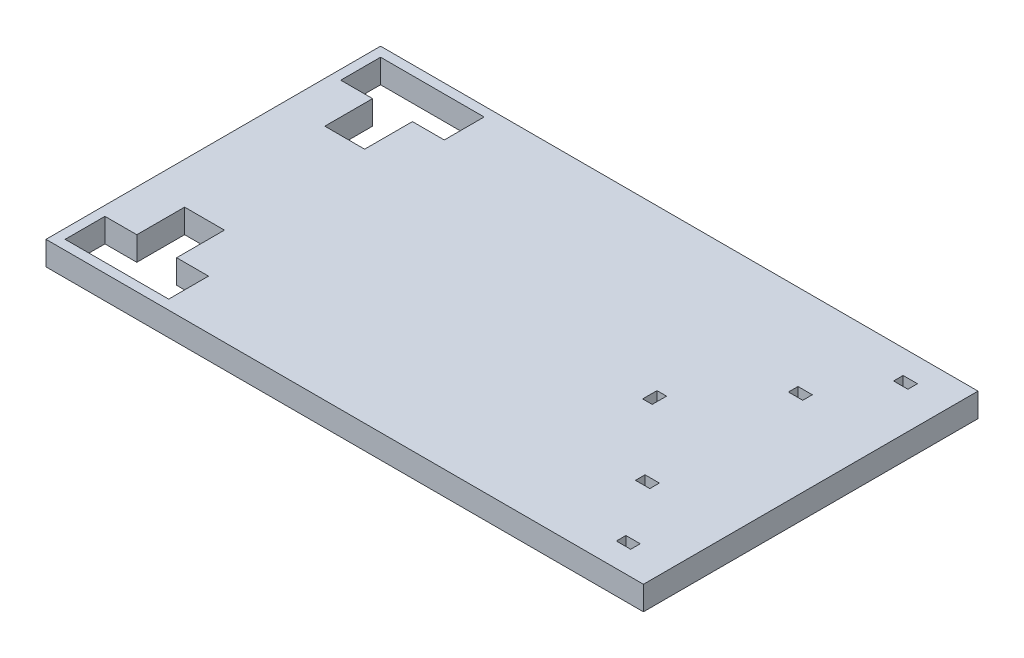
from build123d import *

# Parameters (mm, degrees)
SKETCH1_W           = 375
SKETCH1_H           = 210
BOSS_EXTRUDE1_DEPTH = 15
SKETCH1_5_W         = 25
SKETCH1_5_H         = 30
CUT_EXTRUDE2_DEPTH  = 34
SKETCH1_6_W         = 65
SKETCH1_6_H         = 25
CUT_EXTRUDE3_DEPTH  = 46
SKETCH1_7_W         = 65
SKETCH1_7_H         = 25
CUT_EXTRUDE4_DEPTH  = 48
SKETCH1_8_W         = 25
SKETCH1_8_H         = 30
CUT_EXTRUDE5_DEPTH  = 45
SKETCH1_9_W         = 9
SKETCH1_9_H         = 6
CUT_EXTRUDE6_DEPTH  = 34
SKETCH1_10_W        = 9
SKETCH1_10_H        = 6
CUT_EXTRUDE7_DEPTH  = 31
SKETCH1_11_W        = 6
SKETCH1_11_H        = 9
CUT_EXTRUDE8_DEPTH  = 34
SKETCH1_12_W        = 9
SKETCH1_12_H        = 6
CUT_EXTRUDE9_DEPTH  = 27
SKETCH1_13_W        = 9
SKETCH1_13_H        = 6
CUT_EXTRUDE10_DEPTH = 31


with BuildPart() as part:
    # Sketch1 → Boss-Extrude1 (new body)
    with BuildSketch(Plane(origin=(0, 0, 0), x_dir=(1, 0, 0), z_dir=(0, 1, 0))):
        with Locations((187.5, 105)):
            Rectangle(SKETCH1_W, SKETCH1_H)
    extrude(amount=BOSS_EXTRUDE1_DEPTH)

    # Sketch1<5> → Cut-Extrude2 (cut)
    with BuildSketch(Plane(origin=(0, 0, 0), x_dir=(1, 0, 0), z_dir=(0, 1, 0))):
        with Locations((38.5, 164)):
            Rectangle(SKETCH1_5_W, SKETCH1_5_H)
    extrude(amount=CUT_EXTRUDE2_DEPTH, mode=Mode.SUBTRACT)

    # Sketch1<6> → Cut-Extrude3 (cut)
    with BuildSketch(Plane(origin=(0, 0, 0), x_dir=(1, 0, 0), z_dir=(0, 1, 0))):
        with Locations((38.5, 191.5)):
            Rectangle(SKETCH1_6_W, SKETCH1_6_H)
    extrude(amount=CUT_EXTRUDE3_DEPTH, mode=Mode.SUBTRACT)

    # Sketch1<7> → Cut-Extrude4 (cut)
    with BuildSketch(Plane(origin=(0, 0, 0), x_dir=(1, 0, 0), z_dir=(0, 1, 0))):
        with Locations((38.5, 18.5)):
            Rectangle(SKETCH1_7_W, SKETCH1_7_H)
    extrude(amount=CUT_EXTRUDE4_DEPTH, mode=Mode.SUBTRACT)

    # Sketch1<8> → Cut-Extrude5 (cut)
    with BuildSketch(Plane(origin=(0, 0, 0), x_dir=(1, 0, 0), z_dir=(0, 1, 0))):
        with Locations((38.5, 46)):
            Rectangle(SKETCH1_8_W, SKETCH1_8_H)
    extrude(amount=CUT_EXTRUDE5_DEPTH, mode=Mode.SUBTRACT)

    # Sketch1<9> → Cut-Extrude6 (cut)
    with BuildSketch(Plane(origin=(0, 0, 0), x_dir=(1, 0, 0), z_dir=(0, 1, 0))):
        with Locations((347.5, 18)):
            Rectangle(SKETCH1_9_W, SKETCH1_9_H)
    extrude(amount=CUT_EXTRUDE6_DEPTH, mode=Mode.SUBTRACT)

    # Sketch1<10> → Cut-Extrude7 (cut)
    with BuildSketch(Plane(origin=(0, 0, 0), x_dir=(1, 0, 0), z_dir=(0, 1, 0))):
        with Locations((320.5, 57)):
            Rectangle(SKETCH1_10_W, SKETCH1_10_H)
    extrude(amount=CUT_EXTRUDE7_DEPTH, mode=Mode.SUBTRACT)

    # Sketch1<11> → Cut-Extrude8 (cut)
    with BuildSketch(Plane(origin=(0, 0, 0), x_dir=(1, 0, 0), z_dir=(0, 1, 0))):
        with Locations((277, 105)):
            Rectangle(SKETCH1_11_W, SKETCH1_11_H)
    extrude(amount=CUT_EXTRUDE8_DEPTH, mode=Mode.SUBTRACT)

    # Sketch1<12> → Cut-Extrude9 (cut)
    with BuildSketch(Plane(origin=(0, 0, 0), x_dir=(1, 0, 0), z_dir=(0, 1, 0))):
        with Locations((320.5, 153)):
            Rectangle(SKETCH1_12_W, SKETCH1_12_H)
    extrude(amount=CUT_EXTRUDE9_DEPTH, mode=Mode.SUBTRACT)

    # Sketch1<13> → Cut-Extrude10 (cut)
    with BuildSketch(Plane(origin=(0, 0, 0), x_dir=(1, 0, 0), z_dir=(0, 1, 0))):
        with Locations((347.5, 192)):
            Rectangle(SKETCH1_13_W, SKETCH1_13_H)
    extrude(amount=CUT_EXTRUDE10_DEPTH, mode=Mode.SUBTRACT)


solid = part.part
